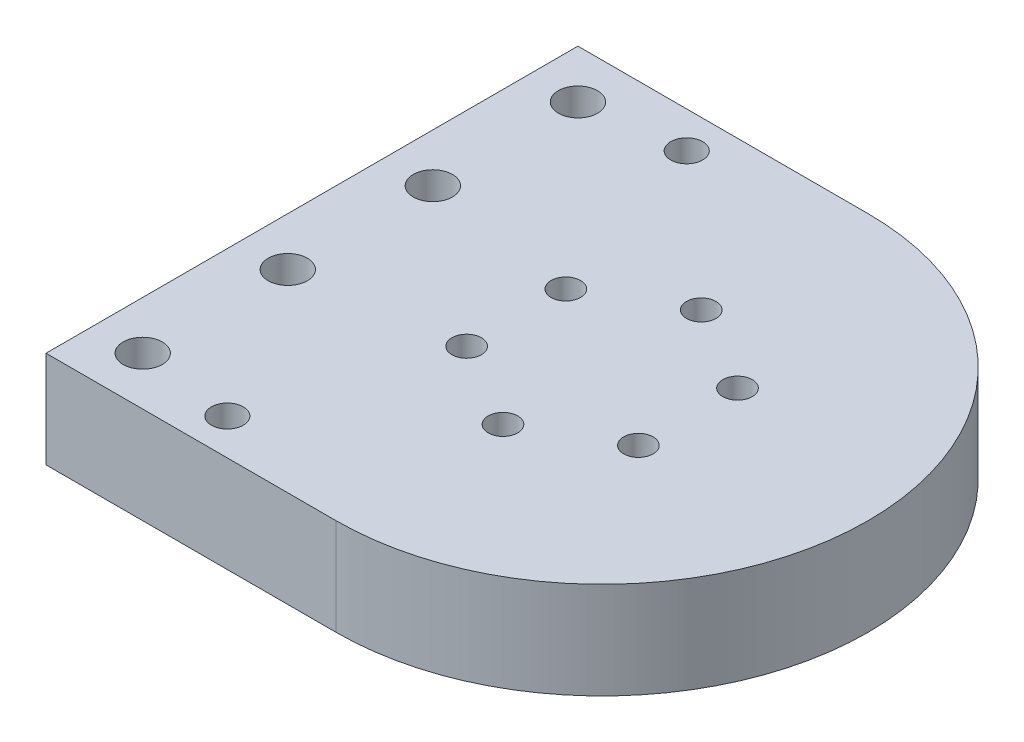
from build123d import *

# Parameters (mm, degrees)
SKETCH_1_R      = 1.65
SKETCH_1_R_2    = 1.525
SKETCH_1_W      = 10
SKETCH_1_H      = 55
SKETCH_1_R_3    = 2.025
EXTRUDE_1_DEPTH = 10


with BuildPart() as part:
    # 草图1 → 凸台-拉伸1 (new body)
    # profile 1 of 2: a face of its own
    with BuildSketch(Plane(origin=(0, 0, 0), x_dir=(1, 0, 0), z_dir=(0, 1, 0))):
        with BuildLine():
            ThreePointArc((0, -27.5), (27.5, 0), (0, 27.5))
            Line((0, 27.5), (-20, 27.5))
            Line((-20, 27.5), (-20, -27.5))
            Line((-20, -27.5), (0, -27.5))
        make_face()
        with Locations(Location((-15, -23.75, 0), (0, 0, 270))):
            Circle(SKETCH_1_R, mode=Mode.SUBTRACT)
        with Locations(Location((-8.876760389, -5.125, 0), (0, 0, 270))):
            Circle(SKETCH_1_R_2, mode=Mode.SUBTRACT)
        with Locations(Location((0, -10.25, 0), (0, 0, 270))):
            Circle(SKETCH_1_R_2, mode=Mode.SUBTRACT)
        with Locations(Location((8.876760389, -5.125, 0), (0, 0, 270))):
            Circle(SKETCH_1_R_2, mode=Mode.SUBTRACT)
        with Locations(Location((-8.876760389, 5.125, 0), (0, 0, 270))):
            Circle(SKETCH_1_R_2, mode=Mode.SUBTRACT)
        with Locations(Location((-15, 23.75, 0), (0, 0, 270))):
            Circle(SKETCH_1_R, mode=Mode.SUBTRACT)
        with Locations(Location((8.876760389, 5.125, 0), (0, 0, 270))):
            Circle(SKETCH_1_R_2, mode=Mode.SUBTRACT)
        with Locations(Location((0, 10.25, 0), (0, 0, 270))):
            Circle(SKETCH_1_R_2, mode=Mode.SUBTRACT)
    # profile 2 of 2: a face of its own
    with BuildSketch(Plane(origin=(0, 0, 0), x_dir=(1, 0, 0), z_dir=(0, 1, 0))):
        with Locations((-25, 0)):
            Rectangle(SKETCH_1_W, SKETCH_1_H)
        with Locations(Location((-25, -22.5, 0), (0, 0, 270))):
            Circle(SKETCH_1_R_3, mode=Mode.SUBTRACT)
        with Locations(Location((-25, -7.5, 0), (0, 0, 270))):
            Circle(SKETCH_1_R_3, mode=Mode.SUBTRACT)
        with Locations(Location((-25, 7.5, 0), (0, 0, 270))):
            Circle(SKETCH_1_R_3, mode=Mode.SUBTRACT)
        with Locations(Location((-25, 22.5, 0), (0, 0, 270))):
            Circle(SKETCH_1_R_3, mode=Mode.SUBTRACT)
    extrude(amount=EXTRUDE_1_DEPTH)


solid = part.part
